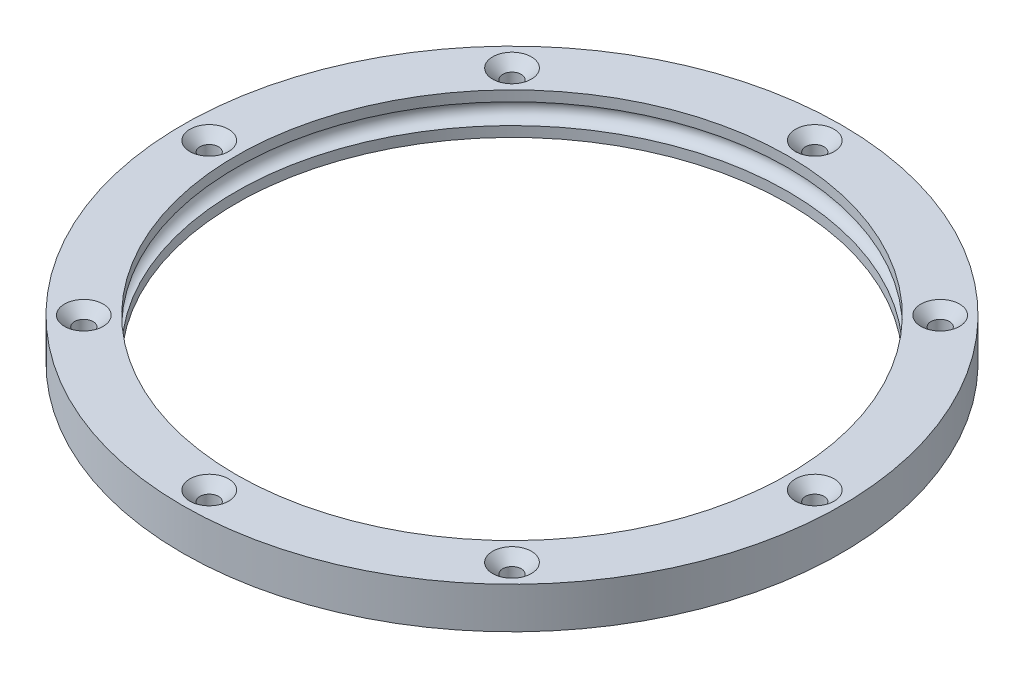
from build123d import *

# Parameters (mm, degrees)
CSK_FOR_M4_COUNTERSUNK_FLAT_HEAD_SCREW1_D           = 4.5
CSK_FOR_M4_COUNTERSUNK_FLAT_HEAD_SCREW1_CSINK_D     = 9.4
CSK_FOR_M4_COUNTERSUNK_FLAT_HEAD_SCREW1_CSINK_ANGLE = 90
CIRPATTERN1_COUNT                                   = 8


with BuildPart() as part:
    # Sketch1 → Revolve1 (revolve)
    with BuildSketch(Plane.XY, mode=Mode.PRIVATE) as revolve1_sk:
        with BuildLine():
            Line((-67, -2.5), (-67, -5))
            Line((-67, -5), (-80, -5))
            Line((-80, -5), (-80, 5))
            Line((-80, 5), (-67, 5))
            Line((-67, 5), (-67, 2.5))
            ThreePointArc((-67, 2.5), (-69.5, 0), (-67, -2.5))
        make_face()
    revolve(revolve1_sk.sketch.rotate(Axis((0, -5.61, 0), (0, 1, 0)), 270), axis=Axis((0, -5.61, 0), (0, 1, 0)))

    # CSK for M4 Countersunk Flat Head Screw1 (through all)
    with Locations(Plane(origin=(0, 5, 0), x_dir=(1, 0, 0), z_dir=(0, 1, 0))):
        with Locations((-73.5, 0)):
            csk_for_m4_countersunk_flat_head_screw1 = CounterSinkHole(CSK_FOR_M4_COUNTERSUNK_FLAT_HEAD_SCREW1_D / 2, CSK_FOR_M4_COUNTERSUNK_FLAT_HEAD_SCREW1_CSINK_D / 2, counter_sink_angle=CSK_FOR_M4_COUNTERSUNK_FLAT_HEAD_SCREW1_CSINK_ANGLE)

    # CirPattern1: CSK for M4 Countersunk Flat Head Screw1 ×8 about axis
    cirpattern1_axis = Axis((0, 0, 0), (0, 1, 0))
    for i in range(1, CIRPATTERN1_COUNT):
        add(csk_for_m4_countersunk_flat_head_screw1.rotate(cirpattern1_axis, i * 360 / CIRPATTERN1_COUNT), mode=Mode.SUBTRACT)


solid = part.part
